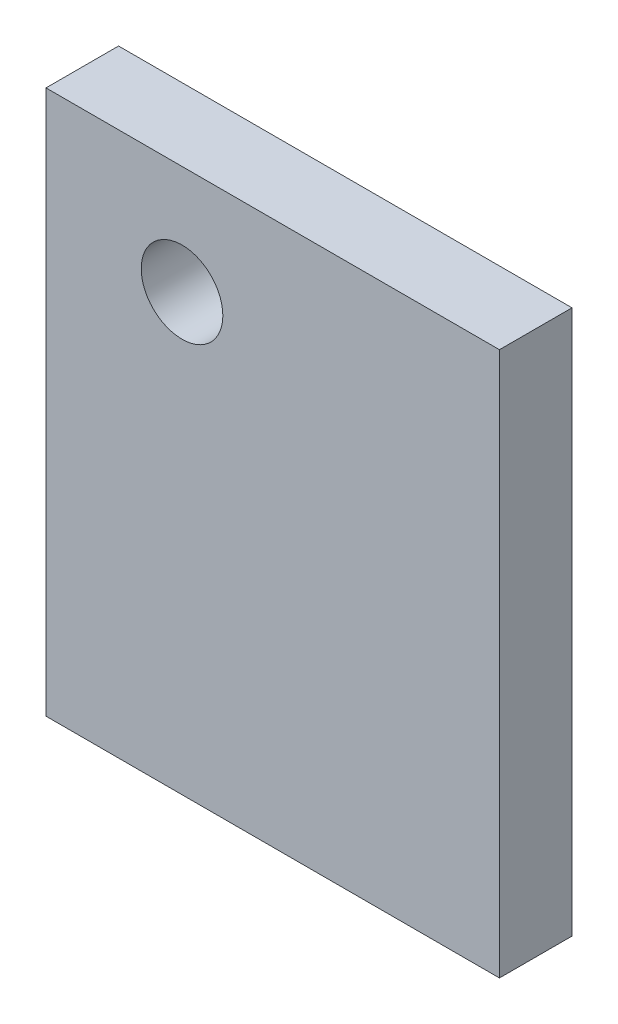
from build123d import *

# Parameters (mm, degrees)
SKETCH1_W           = 50
SKETCH1_H           = 60
SKETCH1_R           = 4.5
BOSS_EXTRUDE1_DEPTH = 8


with BuildPart() as part:
    # Sketch1 → Boss-Extrude1 (new body)
    with BuildSketch(Plane.XY):
        Rectangle(SKETCH1_W, SKETCH1_H)
        with Locations((-10, 18)):
            Circle(SKETCH1_R, mode=Mode.SUBTRACT)
    extrude(amount=BOSS_EXTRUDE1_DEPTH)


solid = part.part
